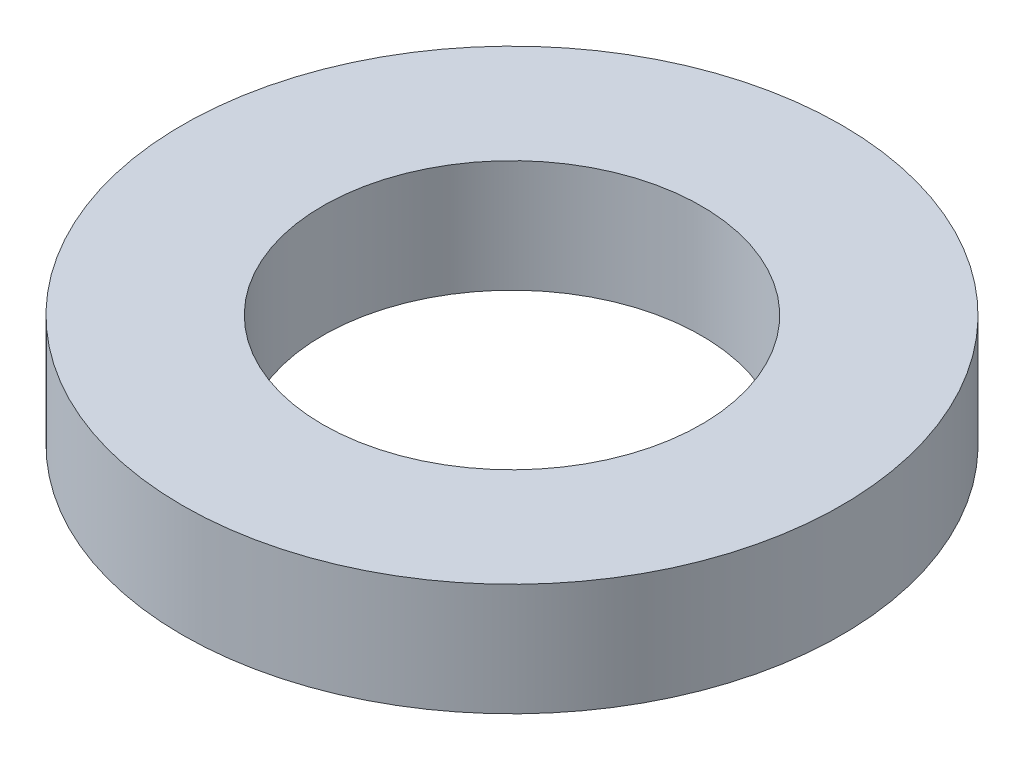
from build123d import *

# Parameters (mm, degrees)
SKETCH_1_R      = 11.75
SKETCH_1_R_2    = 6.75
EXTRUDE_1_DEPTH = 2


with BuildPart() as part:
    # 草图1 → 凸台-拉伸1 (new, symmetric)
    with BuildSketch(Plane(origin=(0, 0, 0), x_dir=(1, 0, 0), z_dir=(0, 1, 0))):
        with Locations(Location((0, 0, 0), (0, 0, 270))):
            Circle(SKETCH_1_R)
        with Locations(Location((0, 0, 0), (0, 0, 270))):
            Circle(SKETCH_1_R_2, mode=Mode.SUBTRACT)
    extrude(amount=EXTRUDE_1_DEPTH, both=True)


solid = part.part
